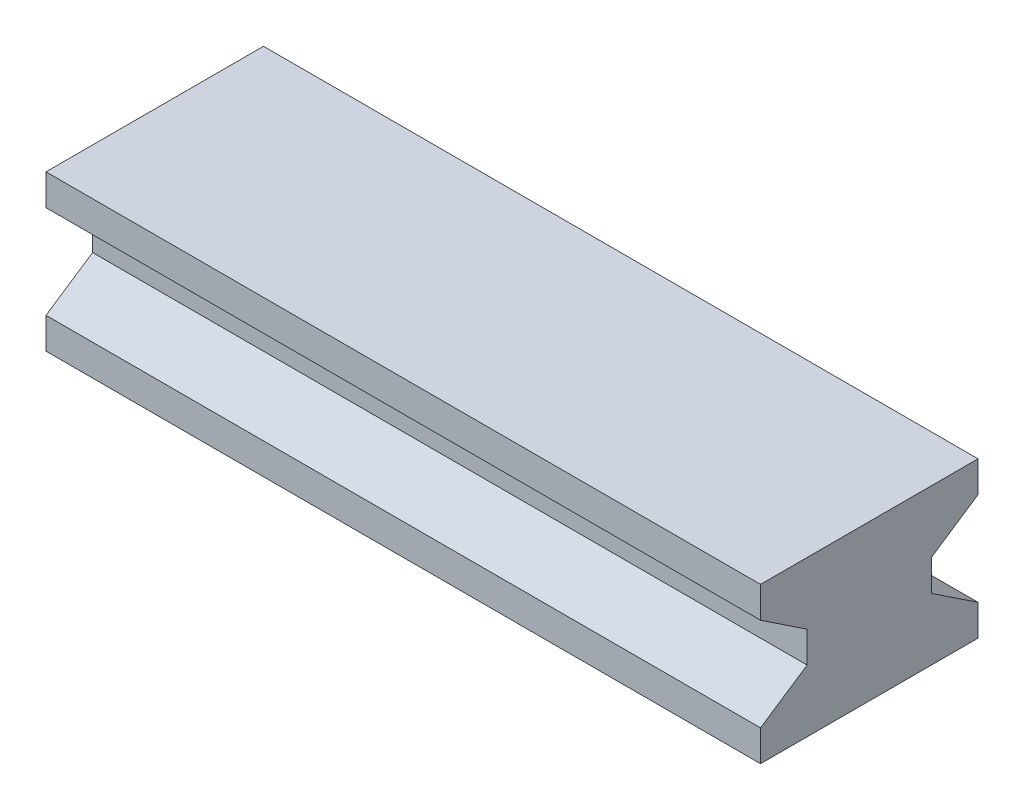
from build123d import *

# Parameters (mm, degrees)
SALIENTE_EXTRUIR1_DEPTH = 230


with BuildPart() as part:
    # Croquis1 → Saliente-Extruir1 (new body)
    with BuildSketch(Plane(origin=(0, 0, 0), x_dir=(0, 0, -1), z_dir=(1, 0, 0))):
        Polygon((-20, -5), (-35, -15), (-35, -25), (35, -25), (35, -15), (20, -5), (20, 5), (35, 15), (35, 25), (-35, 25), (-35, 15), (-20, 5), align=None)
    extrude(amount=SALIENTE_EXTRUIR1_DEPTH)


solid = part.part
